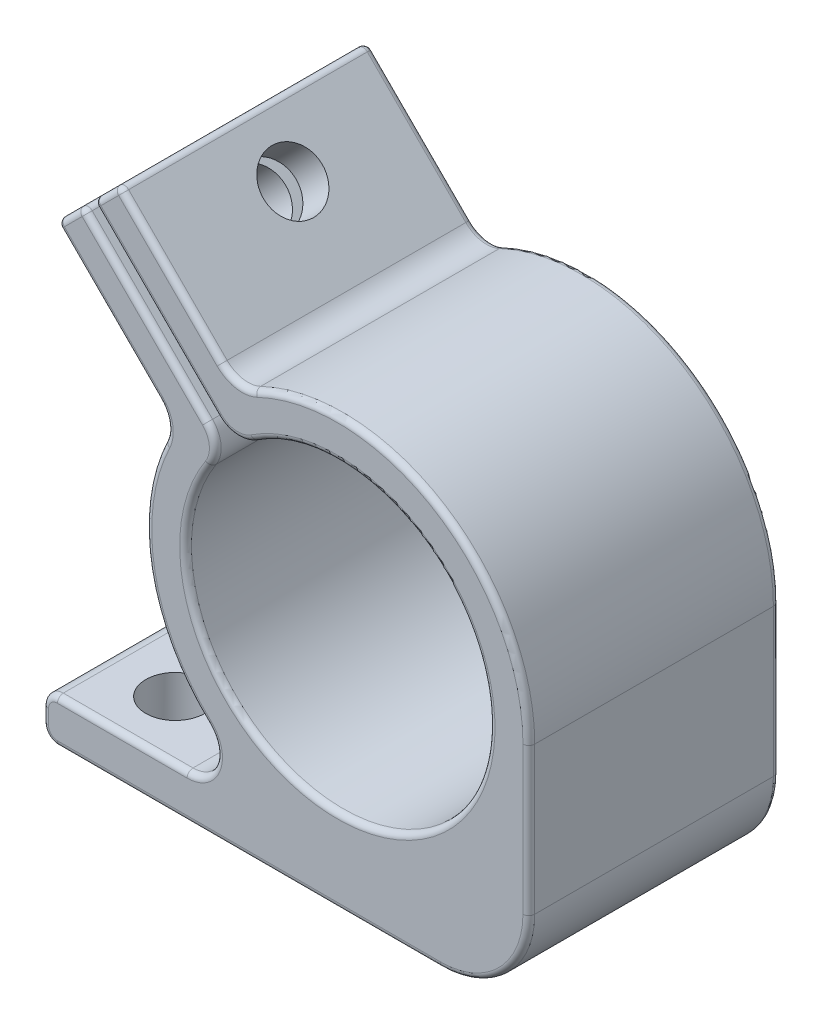
from build123d import *

# Parameters (mm, degrees)
EXTRUDE_1_DEPTH     = 8.5
CUT_EXTRUDE_1_REACH = 22.666
SKETCH_3_R          = 1
FILLET_2_R          = 0.2
SKETCH_5_R          = 1
CUT_EXTRUDE_3_DEPTH = 10


with BuildPart() as part:
    # 草图1 → 凸台-拉伸1 (new body)
    with BuildSketch(Plane.XY):
        with BuildLine():
            Line((-9.5, -6.5), (-5.099019514, -6.5))
            ThreePointArc((-5.099019514, -6.5), (-4.168070177, -5.865148372), (-4.419150245, -4.766666667))
            ThreePointArc((-4.419150245, -4.766666667), (-6.38446509, -1.220084223), (-5.865398026, 2.801268641))
            ThreePointArc((-5.865398026, 2.801268641), (-5.782168393, 3.401335026), (-6.060660172, 3.939339828))
            Line((-6.060660172, 3.939339828), (-9.40452019, 7.283199846))
            ThreePointArc((-9.40452019, 7.283199846), (-9.463098834, 7.424621202), (-9.40452019, 7.566042559))
            Line((-9.40452019, 7.566042559), (-8.803479426, 8.167083323))
            ThreePointArc((-8.803479426, 8.167083323), (-8.66205807, 8.225661966), (-8.520636713, 8.167083323))
            Line((-8.520636713, 8.167083323), (-4.434710467, 4.081157076))
            ThreePointArc((-4.434710467, 4.081157076), (-4.147049322, 3.476210822), (-4.305749403, 2.825424231))
            ThreePointArc((-4.305749403, 2.825424231), (3.641599923, -3.641599923), (-2.825424231, 4.305749403))
            ThreePointArc((-2.825424231, 4.305749403), (-3.476210822, 4.147049322), (-4.081157076, 4.434710467))
            Line((-4.081157076, 4.434710467), (-8.167083323, 8.520636713))
            ThreePointArc((-8.167083323, 8.520636713), (-8.225661966, 8.66205807), (-8.167083323, 8.803479426))
            Line((-8.167083323, 8.803479426), (-7.566042559, 9.40452019))
            ThreePointArc((-7.566042559, 9.40452019), (-7.424621202, 9.463098834), (-7.283199846, 9.40452019))
            Line((-7.283199846, 9.40452019), (-3.939339828, 6.060660172))
            ThreePointArc((-3.939339828, 6.060660172), (-3.401335026, 5.782168393), (-2.801268641, 5.865398026))
            ThreePointArc((-2.801268641, 5.865398026), (3.467113629, 5.498101771), (6.5, 0))
            Line((6.5, 0), (6.5, -5))
            ThreePointArc((6.5, -5), (5.621320344, -7.121320344), (3.5, -8))
            Line((3.5, -8), (-9.5, -8))
            ThreePointArc((-9.5, -8), (-9.853553391, -7.853553391), (-10, -7.5))
            Line((-10, -7.5), (-10, -7))
            ThreePointArc((-10, -7), (-9.853553391, -6.646446609), (-9.5, -6.5))
        make_face()
    extrude(amount=EXTRUDE_1_DEPTH)

    # 草图3 → 切除-拉伸1 (cut, up to next)
    with BuildSketch(Plane(origin=(0, -6.5, 0), x_dir=(1, 0, 0), z_dir=(0, 1, 0)), mode=Mode.PRIVATE) as cut_extrude_1_sk1:
        with Locations(Location((-7.5, -2, 0), (0, 0, 270))):
            Circle(SKETCH_3_R)
    cut_extrude_1_tool1 = extrude(cut_extrude_1_sk1.sketch, amount=-CUT_EXTRUDE_1_REACH, mode=Mode.PRIVATE) & part.part
    # 草图3 → 切除-拉伸1 (cut, up to next)
    with BuildSketch(Plane(origin=(0, -6.5, 0), x_dir=(1, 0, 0), z_dir=(0, 1, 0)), mode=Mode.PRIVATE) as cut_extrude_1_sk2:
        with Locations(Location((-7.5, -6.5, 0), (0, 0, 270))):
            Circle(SKETCH_3_R)
    cut_extrude_1_tool2 = extrude(cut_extrude_1_sk2.sketch, amount=-CUT_EXTRUDE_1_REACH, mode=Mode.PRIVATE) & part.part
    add(cut_extrude_1_tool1.solids().sort_by_distance((-7.5, -6.5, 2))[0], mode=Mode.SUBTRACT)
    add(cut_extrude_1_tool2.solids().sort_by_distance((-7.5, -6.5, 6.5))[0], mode=Mode.SUBTRACT)

    # 圆角2
    fillet_2_edges = [part.edges().sort_by_distance(p)[0] for p in [
        (-5.611269837, 7.732590181, 8.5),
        (-7.424621202, 9.463098834, 8.5),
        (-7.866562941, 9.103999808, 8.5),
        (-8.225661966, 8.66205807, 8.5),
        (6.5, -2.5, 0),
        (5.621320344, -7.121320344, 0),
        (-6.124120199, 6.47767359, 8.5),
        (-3, -8, 0),
        (-9.853553391, -7.853553391, 0),
        (-10, -7.25, 0),
        (-9.853553391, -6.646446609, 0),
        (-7.299509757, -6.5, 0),
        (-4.168070177, -5.865148372, 0),
        (-6.38446509, -1.220084223, 0),
        (-5.782168393, 3.401335026, 0),
        (-3.476210822, 4.147049322, 8.5),
        (-7.732590181, 5.611269837, 0),
        (-9.463098834, 7.424621202, 0),
        (-9.103999808, 7.866562941, 0),
        (-8.66205807, 8.225661966, 0),
        (-6.47767359, 6.124120199, 0),
        (-4.147049322, 3.476210822, 0),
        (3.641599923, -3.641599923, 0),
        (3.641599923, -3.641599923, 8.5),
        (-3.476210822, 4.147049322, 0),
        (-6.124120199, 6.47767359, 0),
        (-8.225661966, 8.66205807, 0),
        (-7.866562941, 9.103999808, 0),
        (-7.424621202, 9.463098834, 0),
        (-5.611269837, 7.732590181, 0),
        (-3.401335026, 5.782168393, 0),
        (3.467113629, 5.498101771, 0),
        (-4.147049322, 3.476210822, 8.5),
        (-6.47767359, 6.124120199, 8.5),
        (-8.66205807, 8.225661966, 8.5),
        (3.467113629, 5.498101771, 8.5),
        (-9.103999808, 7.866562941, 8.5),
        (-9.463098834, 7.424621202, 8.5),
        (-7.732590181, 5.611269837, 8.5),
        (-5.782168393, 3.401335026, 8.5),
        (-6.38446509, -1.220084223, 8.5),
        (-4.168070177, -5.865148372, 8.5),
        (-7.299509757, -6.5, 8.5),
        (-9.853553391, -6.646446609, 8.5),
        (-10, -7.25, 8.5),
        (-9.853553391, -7.853553391, 8.5),
        (-3.401335026, 5.782168393, 8.5),
        (-3, -8, 8.5),
        (5.621320344, -7.121320344, 8.5),
        (6.5, -2.5, 8.5),
    ]]
    fillet(fillet_2_edges, radius=FILLET_2_R)

    # 草图5 → 切除-拉伸3 (cut)
    with BuildSketch(Plane(origin=(-1.060660172, -1.060660172, 0), x_dir=(0, 0, 1), z_dir=(-0.7071067811865477, -0.7071067811865475, 0))):
        with Locations(Location((4, 10, 0), (0, 0, 270))):
            Circle(SKETCH_5_R)
    extrude(amount=-CUT_EXTRUDE_3_DEPTH, mode=Mode.SUBTRACT)


solid = part.part
